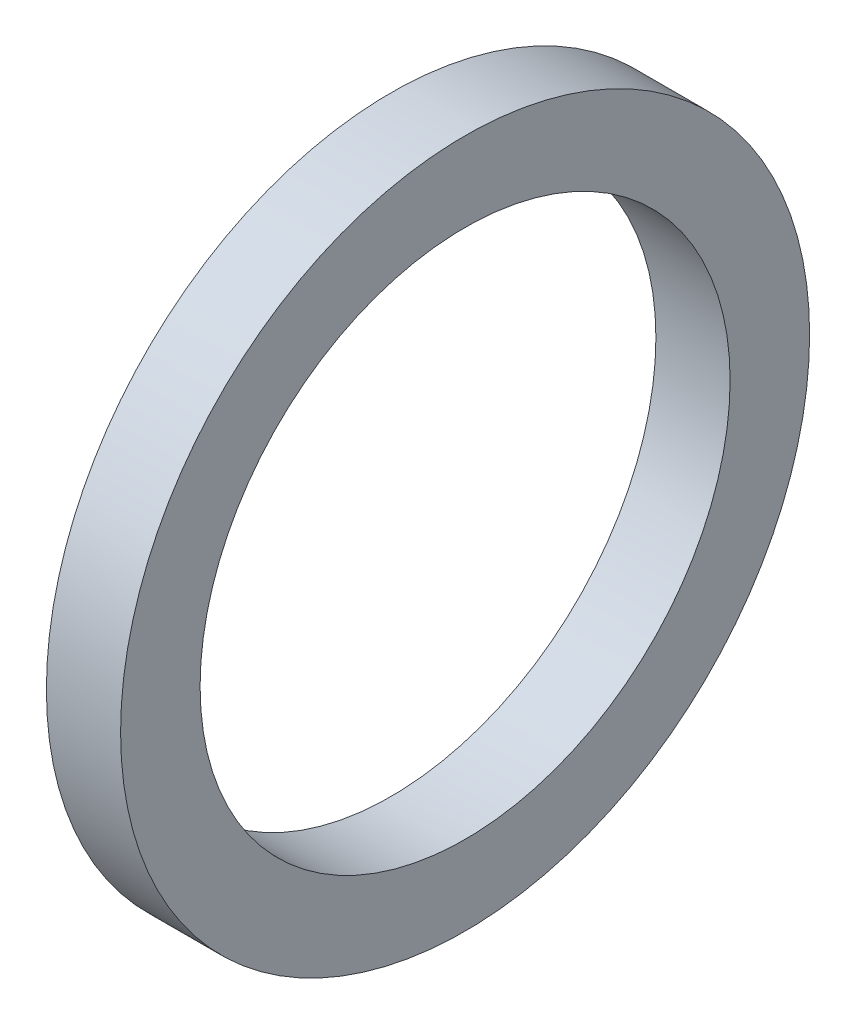
from build123d import *

# Parameters (mm, degrees)
SKETCH1_R           = 32.5
SKETCH1_R_2         = 25
BOSS_EXTRUDE1_DEPTH = 7


with BuildPart() as part:
    # Sketch1 → Boss-Extrude1 (new body)
    with BuildSketch(Plane(origin=(0, 0, 0), x_dir=(0, 0, -1), z_dir=(1, 0, 0))):
        Circle(SKETCH1_R)
        Circle(SKETCH1_R_2, mode=Mode.SUBTRACT)
    extrude(amount=BOSS_EXTRUDE1_DEPTH)


solid = part.part
